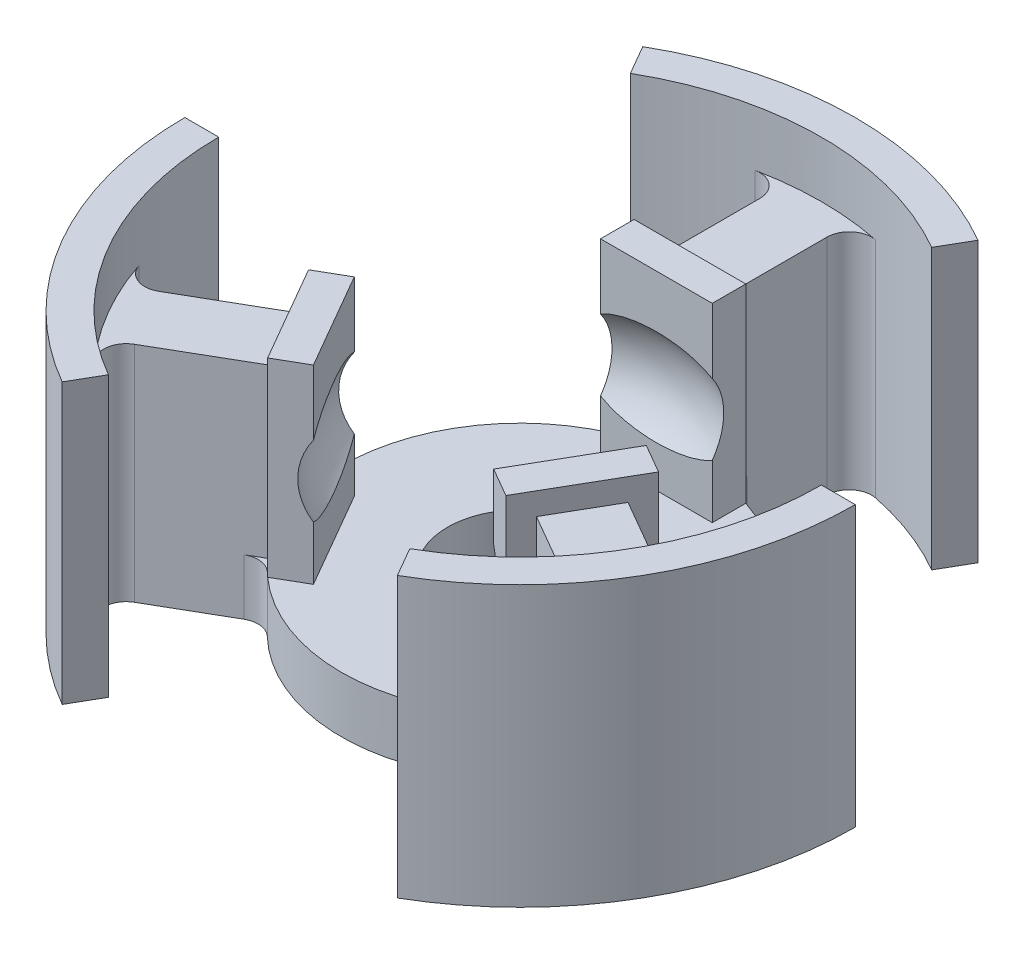
from build123d import *

# Parameters (mm, degrees)
SKETCH_1_R               = 16
SKETCH_1_R_2             = 6.5
EXTRUDE_1_DEPTH          = 5
SKETCH_2_W               = 10
SKETCH_2_H               = 3
EXTRUDE_2_DEPTH          = 22
EXTRUDE_3_DEPTH          = 25
EXTRUDE_4_DEPTH          = 20
FILLET_1_R               = 2
FILLET_2_R               = 2
FILLET_3_R               = 2
FILLET_4_R               = 2
PATTERN_CIRCULAR_4_COUNT = 3
PATTERN_CIRCULAR_5_COUNT = 3
FILLET_5_R               = 2


with BuildPart() as part:
    # 草图1 → 凸台-拉伸1 (new body)
    with BuildSketch(Plane(origin=(0, 0, 0), x_dir=(1, 0, 0), z_dir=(0, 1, 0))):
        with Locations(Location((0, 0, 0), (0, 0, 270))):
            Circle(SKETCH_1_R)
        with Locations(Location((0, 0, 0), (0, 0, 270))):
            Circle(SKETCH_1_R_2, mode=Mode.SUBTRACT)
    extrude(amount=EXTRUDE_1_DEPTH)

    # 草图2 → 凸台-拉伸2 (add)
    with BuildSketch(Plane(origin=(0, 0, 0), x_dir=(1, 0, 0), z_dir=(0, 1, 0))):
        with Locations((-1.78e-15, 13.698684153570664)):
            Rectangle(SKETCH_2_W, SKETCH_2_H)
    extrude_2 = extrude(amount=EXTRUDE_2_DEPTH)



with BuildPart() as body_2:
    # 草图3 → 凸台-拉伸3 (new body)
    with BuildSketch(Plane(origin=(0, 0, 0), x_dir=(1, 0, 0), z_dir=(0, 1, 0))):
        with BuildLine():
            Line((-15.000000000000039, 25.98076211353314), (-13.484105265359647, 23.355155414209925))
            ThreePointArc((-13.484105265359647, 23.355155414209925), (1.65e-15, 26.968210530719293), (13.484105265359647, 23.355155414209925))
            Line((13.484105265359647, 23.355155414209925), (15.000000000000039, 25.98076211353314))
            ThreePointArc((15.000000000000039, 25.98076211353314), (1.84e-15, 30), (-15.000000000000039, 25.98076211353314))
        make_face()
    extrude_3 = extrude(amount=EXTRUDE_3_DEPTH)


with BuildPart() as part_1:
    add(part.part)

    add(body_2.part)  # 凸台-拉伸4 merges body 2
    # 草图4 → 凸台-拉伸4 (add)
    with BuildSketch(Plane(origin=(0, 0, 0), x_dir=(1, 0, 0), z_dir=(0, 1, 0))):
        Polygon((2.9999999999999964, 14.402885682574833), (-3.000000000000003, 14.402885682574832), (-3.0000000000000036, 27.990866329379006), (2.9999999999999964, 27.990866329379006), align=None)
    extrude_4 = extrude(amount=EXTRUDE_4_DEPTH)

    # 草图5 → 切除-旋转1 (revolve, cut)
    with BuildSketch(Plane(origin=(0, 0, 0), x_dir=(0, 0, -1), z_dir=(1, 0, 0))):
        with BuildLine():
            Line((12.198684153570664, 17.303207954702064), (8.4, 13))
            Line((8.4, 13), (12.198684153570664, 8.696792045297935))
            ThreePointArc((12.198684153570664, 8.696792045297935), (14.139999999999999, 13), (12.198684153570664, 17.303207954702064))
        make_face()
    cut_revolve_1 = revolve(axis=Axis((0, -2.5210076515236324, 0), (0, 1, 0)), mode=Mode.SUBTRACT)

    # 圆角1
    fillet_1_edges = [part_1.edges().sort_by_distance(p)[0] for p in [
        (2.9999999999999964, 10, -26.80082795790456),
    ]]
    fillet(fillet_1_edges, radius=FILLET_1_R)

    # 圆角2
    fillet_2_edges = [part_1.edges().sort_by_distance(p)[0] for p in [
        (-3.0000000000000036, 10, -26.80082795790456),
    ]]
    fillet(fillet_2_edges, radius=FILLET_2_R)

    # 圆角3
    fillet_3_edges = [part_1.edges().sort_by_distance(p)[0] for p in [
        (-3.000000000000003, 2.5, -15.71623364550171),
    ]]
    fillet(fillet_3_edges, radius=FILLET_3_R)

    # 圆角4
    fillet_4_edges = [part_1.edges().sort_by_distance(p)[0] for p in [
        (2.9999999999999964, 2.5, -15.716233645501712),
    ]]
    fillet(fillet_4_edges, radius=FILLET_4_R)

    # 阵列(圆周)4: 凸台-拉伸2, 凸台-拉伸4, 切除-旋转1 ×3 about axis
    pattern_circular_4_axis = Axis((1.5e-16, 0, 7.6e-16), (0, 1, 0))
    add([extrude_2.rotate(pattern_circular_4_axis, i * 360 / PATTERN_CIRCULAR_4_COUNT) for i in range(1, PATTERN_CIRCULAR_4_COUNT)])
    add([extrude_4.rotate(pattern_circular_4_axis, i * 360 / PATTERN_CIRCULAR_4_COUNT) for i in range(1, PATTERN_CIRCULAR_4_COUNT)])
    add([cut_revolve_1.rotate(pattern_circular_4_axis, i * 360 / PATTERN_CIRCULAR_4_COUNT) for i in range(1, PATTERN_CIRCULAR_4_COUNT)], mode=Mode.SUBTRACT)

    # 阵列(圆周)5: 凸台-拉伸3 ×3 about axis
    pattern_circular_5_axis = Axis((3.1e-16, 0, 6.1e-16), (0, 1, 0))
    for i in range(1, PATTERN_CIRCULAR_5_COUNT):
        add(extrude_3.rotate(pattern_circular_5_axis, i * 360 / PATTERN_CIRCULAR_5_COUNT))

    # 圆角5
    fillet_5_edges = [part_1.edges().sort_by_distance(p)[0] for p in [
        (12.110657588816196, 2.5, 10.456193034104174),
        (15.110657588816197, 2.5, 5.260040611397544),
        (-15.110657588816201, 2.5, 5.260040611397544),
        (-12.110657588816197, 2.5, 10.456193034104171),
        (24.710197854001564, 10, 10.802337767598974),
        (21.71019785400156, 10, 15.998490190305604),
        (-21.71019785400157, 10, 15.998490190305594),
        (-24.71019785400157, 10, 10.802337767598964),
    ]]
    fillet(fillet_5_edges, radius=FILLET_5_R)


solid = part_1.part
